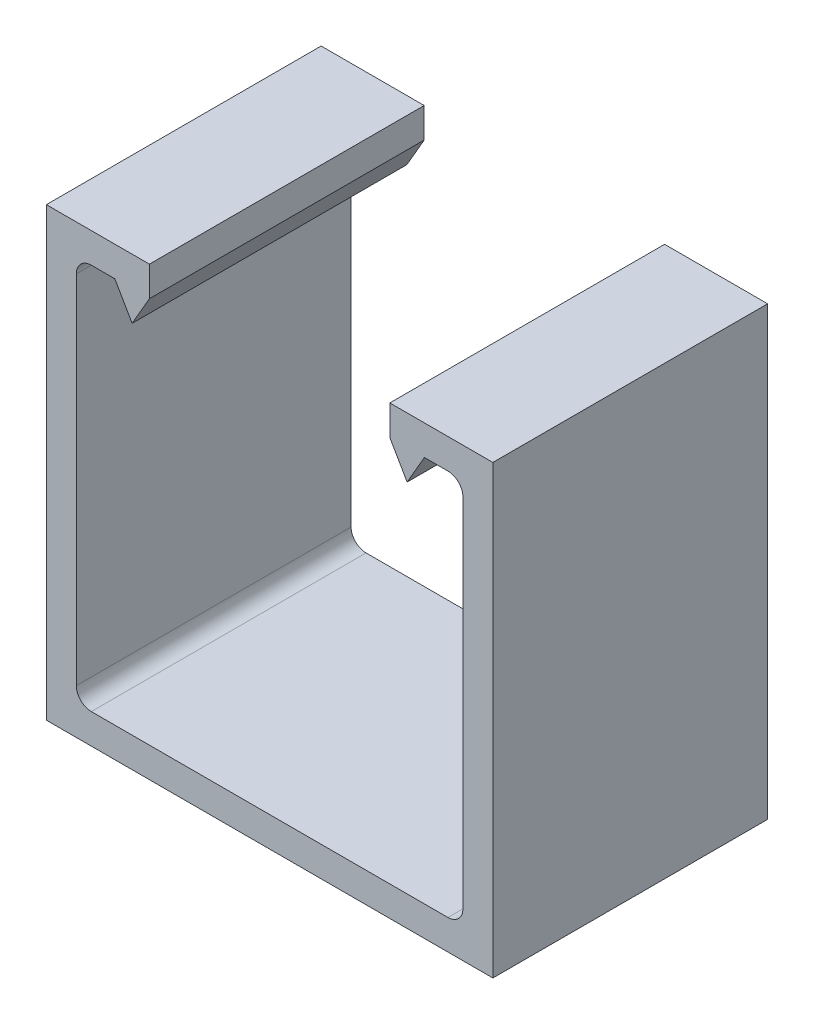
from build123d import *

# Parameters (mm, degrees)
BASE_EXTRUDE_DEPTH = 12.7


with BuildPart() as part:
    # Sketch1 → Base-Extrude (new, symmetric)
    with BuildSketch(Plane.XY):
        with BuildLine():
            Line((-11.1125, 20.6375), (-20.6375, 20.6375))
            Line((-20.6375, 20.6375), (-20.6375, -20.6375))
            Line((-20.6375, -20.6375), (20.6375, -20.6375))
            Line((20.6375, -20.6375), (20.6375, 20.6375))
            Line((20.6375, 20.6375), (11.1125, 20.6375))
            Line((11.1125, 20.6375), (11.1125, 17.8689))
            Line((11.1125, 17.8689), (12.710951958, 15.1003))
            Line((12.710951958, 15.1003), (14.309403911, 17.8689))
            Line((14.309403911, 17.8689), (16.4846, 17.8689))
            ThreePointArc((16.4846, 17.8689), (17.463447917, 17.463447917), (17.8689, 16.4846))
            Line((17.8689, 16.4846), (17.8689, -16.4846))
            ThreePointArc((17.8689, -16.4846), (17.463447917, -17.463447917), (16.4846, -17.8689))
            Line((16.4846, -17.8689), (-16.4846, -17.8689))
            ThreePointArc((-16.4846, -17.8689), (-17.463447917, -17.463447917), (-17.8689, -16.4846))
            Line((-17.8689, -16.4846), (-17.8689, 16.4846))
            ThreePointArc((-17.8689, 16.4846), (-17.463447917, 17.463447917), (-16.4846, 17.8689))
            Line((-16.4846, 17.8689), (-14.309403911, 17.8689))
            Line((-14.309403911, 17.8689), (-12.710951958, 15.1003))
            Line((-12.710951958, 15.1003), (-11.1125, 17.8689))
            Line((-11.1125, 17.8689), (-11.1125, 20.6375))
        make_face()
    extrude(amount=BASE_EXTRUDE_DEPTH, both=True)


solid = part.part
